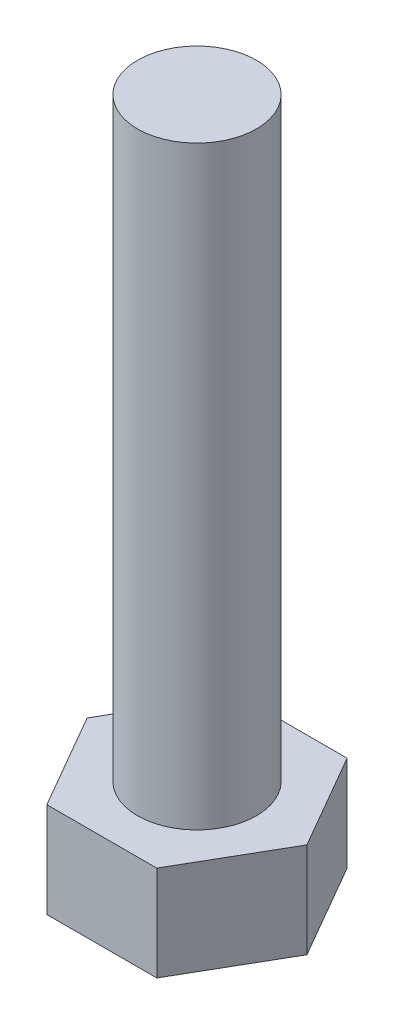
from build123d import *

# Parameters (mm, degrees)
BOSS_EXTRUDE1_DEPTH = 4
SKETCH2_R           = 2.5
BOSS_EXTRUDE2_DEPTH = 25


with BuildPart() as part:
    # Sketch1 → Boss-Extrude1 (new body)
    with BuildSketch(Plane(origin=(0, 0, 0), x_dir=(1, 0, 0), z_dir=(0, 1, 0))):
        Polygon((4.618802154, 0), (2.309401077, 4), (-2.309401077, 4), (-4.618802154, 0), (-2.309401077, -4), (2.309401077, -4), align=None)
    extrude(amount=BOSS_EXTRUDE1_DEPTH)

    # Sketch2 → Boss-Extrude2 (add)
    with BuildSketch(Plane(origin=(0, 4, 0), x_dir=(1, 0, 0), z_dir=(0, 1, 0))):
        with Locations(Location((0, 0, 0), (0, 0, 270))):
            Circle(SKETCH2_R)
    extrude(amount=BOSS_EXTRUDE2_DEPTH)


solid = part.part
